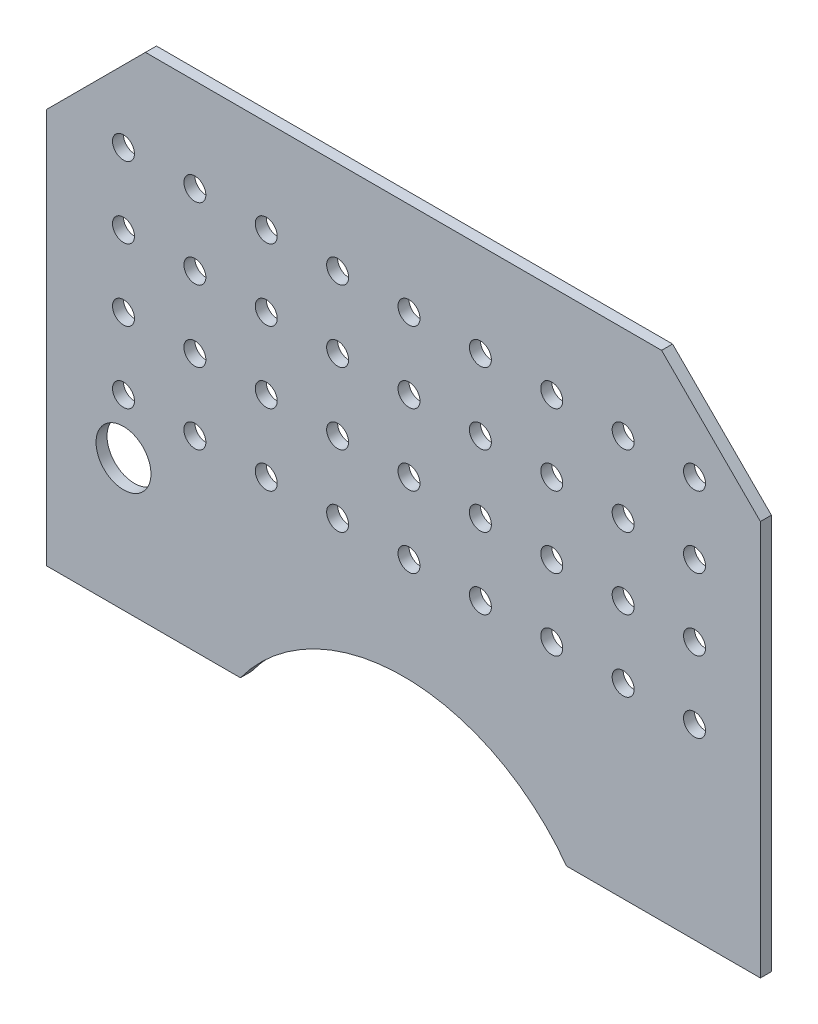
from build123d import *

# Parameters (mm, degrees)
EXTRUDE_1_DEPTH     = 0.1
SKETCH_2_R          = 0.25
CUT_EXTRUDE_1_DEPTH = 25.010783515
SKETCH_3_R          = 0.1
CUT_EXTRUDE_2_DEPTH = 25.010783515


with BuildPart() as part:
    # Эскиз1 → Бобышка-Вытянуть1 (new body)
    with BuildSketch(Plane.XY):
        with BuildLine():
            Line((3.78, -22.45), (2.015, -22.45))
            Line((2.015, -22.45), (2.015, -18.85))
            Line((2.015, -18.85), (2.915, -17.95))
            Line((2.915, -17.95), (7.615, -17.95))
            Line((7.615, -17.95), (8.515, -18.85))
            Line((8.515, -18.85), (8.515, -22.45))
            Line((8.515, -22.45), (6.75, -22.45))
            ThreePointArc((6.75, -22.45), (5.265, -21.696450643), (3.78, -22.45))
        make_face()
    extrude(amount=EXTRUDE_1_DEPTH)

    # Эскиз2 → Вырез-Вытянуть1 (cut, through all)
    with BuildSketch(Plane.XY.offset(0.1)):
        with Locations((2.715, -21.25)):
            Circle(SKETCH_2_R)
    extrude(amount=-CUT_EXTRUDE_1_DEPTH, mode=Mode.SUBTRACT)

    # Эскиз3 → Вырез-Вытянуть2 (cut, through all)
    with BuildSketch(Plane.XY.offset(0.1)):
        with Locations((2.715, -20.75)):
            Circle(SKETCH_3_R)
        with Locations((3.365, -20.75)):
            Circle(SKETCH_3_R)
        with Locations((4.015, -20.75)):
            Circle(SKETCH_3_R)
        with Locations((4.665, -20.75)):
            Circle(SKETCH_3_R)
        with Locations((5.315, -20.75)):
            Circle(SKETCH_3_R)
        with Locations((5.965, -20.75)):
            Circle(SKETCH_3_R)
        with Locations((6.615, -20.75)):
            Circle(SKETCH_3_R)
        with Locations((7.265, -20.75)):
            Circle(SKETCH_3_R)
        with Locations((7.915, -20.75)):
            Circle(SKETCH_3_R)
        with Locations((3.365, -20.1)):
            Circle(SKETCH_3_R)
        with Locations((4.015, -20.1)):
            Circle(SKETCH_3_R)
        with Locations((4.665, -20.1)):
            Circle(SKETCH_3_R)
        with Locations((5.315, -20.1)):
            Circle(SKETCH_3_R)
        with Locations((5.965, -20.1)):
            Circle(SKETCH_3_R)
        with Locations((6.615, -20.1)):
            Circle(SKETCH_3_R)
        with Locations((7.265, -20.1)):
            Circle(SKETCH_3_R)
        with Locations((7.915, -20.1)):
            Circle(SKETCH_3_R)
        with Locations((3.365, -19.45)):
            Circle(SKETCH_3_R)
        with Locations((4.015, -19.45)):
            Circle(SKETCH_3_R)
        with Locations((4.665, -19.45)):
            Circle(SKETCH_3_R)
        with Locations((5.315, -19.45)):
            Circle(SKETCH_3_R)
        with Locations((5.965, -19.45)):
            Circle(SKETCH_3_R)
        with Locations((6.615, -19.45)):
            Circle(SKETCH_3_R)
        with Locations((7.265, -19.45)):
            Circle(SKETCH_3_R)
        with Locations((7.915, -19.45)):
            Circle(SKETCH_3_R)
        with Locations((3.365, -18.8)):
            Circle(SKETCH_3_R)
        with Locations((4.015, -18.8)):
            Circle(SKETCH_3_R)
        with Locations((4.665, -18.8)):
            Circle(SKETCH_3_R)
        with Locations((5.315, -18.8)):
            Circle(SKETCH_3_R)
        with Locations((5.965, -18.8)):
            Circle(SKETCH_3_R)
        with Locations((6.615, -18.8)):
            Circle(SKETCH_3_R)
        with Locations((7.265, -18.8)):
            Circle(SKETCH_3_R)
        with Locations((7.915, -18.8)):
            Circle(SKETCH_3_R)
        with Locations((2.715, -20.1)):
            Circle(SKETCH_3_R)
        with Locations((2.715, -19.45)):
            Circle(SKETCH_3_R)
        with Locations((2.715, -18.8)):
            Circle(SKETCH_3_R)
    extrude(amount=-CUT_EXTRUDE_2_DEPTH, mode=Mode.SUBTRACT)


solid = part.part
